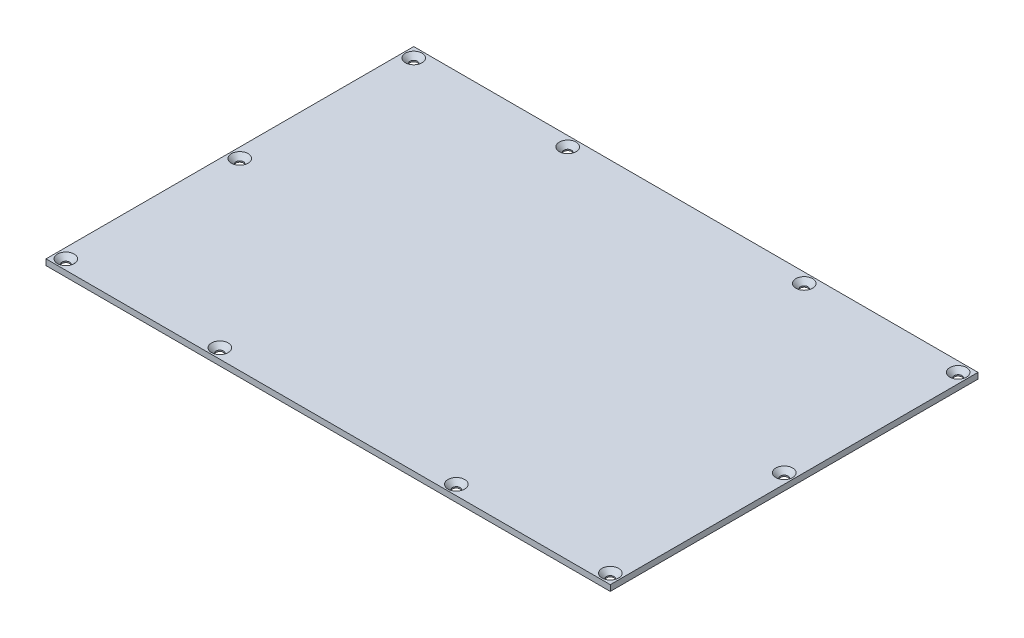
from build123d import *

# Parameters (mm, degrees)
SKETCH1_W                                      = 227.86
SKETCH1_H                                      = 148.48
SKETCH1_R                                      = 1.5
BOSS_EXTRUDE1_DEPTH                            = 2.38125
CSK_FOR_M3_FLAT_HEAD_MACHINE_SCREW6_AT_2_COUNT = 2
CSK_FOR_M3_FLAT_HEAD_MACHINE_SCREW6_AT_2_PITCH = 62.18
CSK_FOR_M3_FLAT_HEAD_MACHINE_SCREW6_AT_3_COUNT = 2
CSK_FOR_M3_FLAT_HEAD_MACHINE_SCREW6_AT_3_PITCH = 219.86
CSK_FOR_M3_FLAT_HEAD_MACHINE_SCREW6_AT_4_COUNT = 2
CSK_FOR_M3_FLAT_HEAD_MACHINE_SCREW6_AT_4_PITCH = 157.68
CSK_FOR_M3_FLAT_HEAD_MACHINE_SCREW6_AT_5_COUNT = 2
CSK_FOR_M3_FLAT_HEAD_MACHINE_SCREW6_AT_5_PITCH = 260.908125592
CSK_FOR_M3_FLAT_HEAD_MACHINE_SCREW6_AT_6_COUNT = 2
CSK_FOR_M3_FLAT_HEAD_MACHINE_SCREW6_AT_6_PITCH = 211.181468884
CSK_FOR_M3_FLAT_HEAD_MACHINE_SCREW6_AT_7_COUNT = 2
CSK_FOR_M3_FLAT_HEAD_MACHINE_SCREW6_AT_7_PITCH = 153.626113666
CSK_FOR_M3_FLAT_HEAD_MACHINE_SCREW6_AT_8_COUNT = 2
CSK_FOR_M3_FLAT_HEAD_MACHINE_SCREW6_AT_8_PITCH = 140.48
CSK_FOR_M3_FLAT_HEAD_MACHINE_SCREW7_AT_2_COUNT = 2
CSK_FOR_M3_FLAT_HEAD_MACHINE_SCREW7_AT_2_PITCH = 219.86


with BuildPart() as part:
    # Sketch1 → Boss-Extrude1 (new body)
    with BuildSketch(Plane(origin=(0, 0, 0), x_dir=(1, 0, 0), z_dir=(0, 1, 0))):
        with Locations((-113.93, -74.24)):
            Rectangle(SKETCH1_W, SKETCH1_H)
        with Locations(Location((-4, -74.24, 0), (0, 0, 90))):
            Circle(SKETCH1_R, mode=Mode.SUBTRACT)
        with Locations(Location((-223.86, -74.24, 0), (0, 0, 90))):
            Circle(SKETCH1_R, mode=Mode.SUBTRACT)
        with Locations(Location((-161.68, -144.48, 0), (0, 0, 90))):
            Circle(SKETCH1_R, mode=Mode.SUBTRACT)
        with Locations(Location((-66.18, -144.48, 0), (0, 0, 90))):
            Circle(SKETCH1_R, mode=Mode.SUBTRACT)
        with Locations(Location((-66.18, -4, 0), (0, 0, 90))):
            Circle(SKETCH1_R, mode=Mode.SUBTRACT)
        with Locations(Location((-161.68, -4, 0), (0, 0, 90))):
            Circle(SKETCH1_R, mode=Mode.SUBTRACT)
        with Locations(Location((-4, -144.48, 0), (0, 0, 90))):
            Circle(SKETCH1_R, mode=Mode.SUBTRACT)
        with Locations(Location((-223.86, -144.48, 0), (0, 0, 90))):
            Circle(SKETCH1_R, mode=Mode.SUBTRACT)
        with Locations(Location((-223.86, -4, 0), (0, 0, 90))):
            Circle(SKETCH1_R, mode=Mode.SUBTRACT)
        with Locations(Location((-4, -4, 0), (0, 0, 90))):
            Circle(SKETCH1_R, mode=Mode.SUBTRACT)
    extrude(amount=BOSS_EXTRUDE1_DEPTH)

    # Sketch22 → CSK for M3 Flat Head Machine Screw6 (revolve, cut)
    with BuildSketch(Plane(origin=(-4, 2.38125, 144.48), x_dir=(0, 0, 1), z_dir=(1, 0, 0))):
        Polygon((0, 0), (0, 2.38125), (1.5, 2.38125), (1.5, 1.875), (3.375, 0), align=None)
    csk_for_m3_flat_head_machine_screw6 = revolve(axis=Axis((-4, 8.73125, 144.48), (0, -1, 0)), mode=Mode.SUBTRACT)

    # CSK for M3 Flat Head Machine Screw6 at 2: CSK for M3 Flat Head Machine Screw6 ×2
    with Locations(*[(-i * CSK_FOR_M3_FLAT_HEAD_MACHINE_SCREW6_AT_2_PITCH, 0, 0) for i in range(1, CSK_FOR_M3_FLAT_HEAD_MACHINE_SCREW6_AT_2_COUNT)]):
        add(csk_for_m3_flat_head_machine_screw6, mode=Mode.SUBTRACT)

    # CSK for M3 Flat Head Machine Screw6 at 3: CSK for M3 Flat Head Machine Screw6 ×2
    with Locations(*[(-i * CSK_FOR_M3_FLAT_HEAD_MACHINE_SCREW6_AT_3_PITCH, 0, 0) for i in range(1, CSK_FOR_M3_FLAT_HEAD_MACHINE_SCREW6_AT_3_COUNT)]):
        add(csk_for_m3_flat_head_machine_screw6, mode=Mode.SUBTRACT)

    # CSK for M3 Flat Head Machine Screw6 at 4: CSK for M3 Flat Head Machine Screw6 ×2
    with Locations(*[(-i * CSK_FOR_M3_FLAT_HEAD_MACHINE_SCREW6_AT_4_PITCH, 0, 0) for i in range(1, CSK_FOR_M3_FLAT_HEAD_MACHINE_SCREW6_AT_4_COUNT)]):
        add(csk_for_m3_flat_head_machine_screw6, mode=Mode.SUBTRACT)

    # CSK for M3 Flat Head Machine Screw6 at 5: CSK for M3 Flat Head Machine Screw6 ×2
    with Locations(*[Vector(-0.8426721072830771, 0, -0.5384270791918794) * (i * CSK_FOR_M3_FLAT_HEAD_MACHINE_SCREW6_AT_5_PITCH) for i in range(1, CSK_FOR_M3_FLAT_HEAD_MACHINE_SCREW6_AT_5_COUNT)]):
        add(csk_for_m3_flat_head_machine_screw6, mode=Mode.SUBTRACT)

    # CSK for M3 Flat Head Machine Screw6 at 6: CSK for M3 Flat Head Machine Screw6 ×2
    with Locations(*[Vector(-0.7466564222385392, 0, -0.6652098820146497) * (i * CSK_FOR_M3_FLAT_HEAD_MACHINE_SCREW6_AT_6_PITCH) for i in range(1, CSK_FOR_M3_FLAT_HEAD_MACHINE_SCREW6_AT_6_COUNT)]):
        add(csk_for_m3_flat_head_machine_screw6, mode=Mode.SUBTRACT)

    # CSK for M3 Flat Head Machine Screw6 at 7: CSK for M3 Flat Head Machine Screw6 ×2
    with Locations(*[Vector(-0.40474889663187463, 0, -0.9144278706794101) * (i * CSK_FOR_M3_FLAT_HEAD_MACHINE_SCREW6_AT_7_PITCH) for i in range(1, CSK_FOR_M3_FLAT_HEAD_MACHINE_SCREW6_AT_7_COUNT)]):
        add(csk_for_m3_flat_head_machine_screw6, mode=Mode.SUBTRACT)

    # CSK for M3 Flat Head Machine Screw6 at 8: CSK for M3 Flat Head Machine Screw6 ×2
    with Locations(*[(0, 0, -i * CSK_FOR_M3_FLAT_HEAD_MACHINE_SCREW6_AT_8_PITCH) for i in range(1, CSK_FOR_M3_FLAT_HEAD_MACHINE_SCREW6_AT_8_COUNT)]):
        add(csk_for_m3_flat_head_machine_screw6, mode=Mode.SUBTRACT)

    # Sketch24 → CSK for M3 Flat Head Machine Screw7 (revolve, cut)
    with BuildSketch(Plane(origin=(-4, 2.38125, 74.24), x_dir=(0, 0, 1), z_dir=(1, 0, 0))):
        Polygon((0, 0), (0, 2.38125), (1.5, 2.38125), (1.5, 1.875), (3.375, 0), align=None)
    csk_for_m3_flat_head_machine_screw7 = revolve(axis=Axis((-4, 8.73125, 74.24), (0, -1, 0)), mode=Mode.SUBTRACT)

    # CSK for M3 Flat Head Machine Screw7 at 2: CSK for M3 Flat Head Machine Screw7 ×2
    with Locations(*[(-i * CSK_FOR_M3_FLAT_HEAD_MACHINE_SCREW7_AT_2_PITCH, 0, 0) for i in range(1, CSK_FOR_M3_FLAT_HEAD_MACHINE_SCREW7_AT_2_COUNT)]):
        add(csk_for_m3_flat_head_machine_screw7, mode=Mode.SUBTRACT)


solid = part.part
